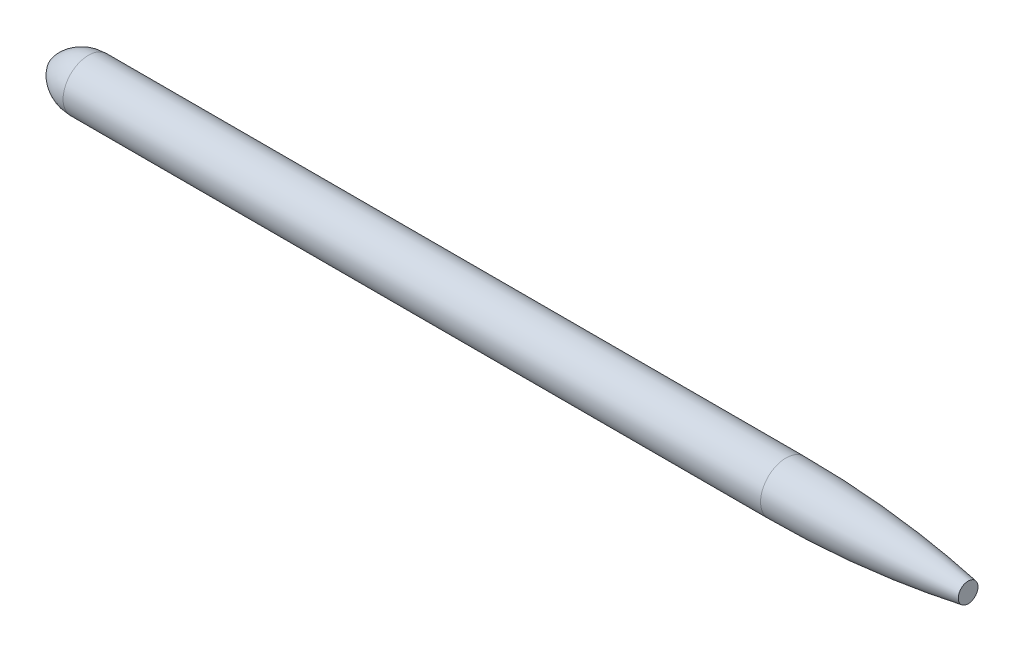
from build123d import *


with BuildPart() as part:
    # rootSketch → Revolve1 (revolve)
    with BuildSketch(Plane(origin=(0, 0, 0), x_dir=(1, 0, 0), z_dir=(0, 1, 0))):
        with BuildLine():
            Line((0, 0), (6500, 0))
            Line((6500, 0), (6500, -70))
            ThreePointArc((6500, -70), (5857.340713998, -152.450191436), (5210, -180))
            Line((5210, -180), (270, -180))
            ThreePointArc((270, -180), (107.750192604, -130.874711094), (0, 0))
        make_face()
    revolve(axis=Axis((0, 0, 0), (1, 0, 0)))


solid = part.part
